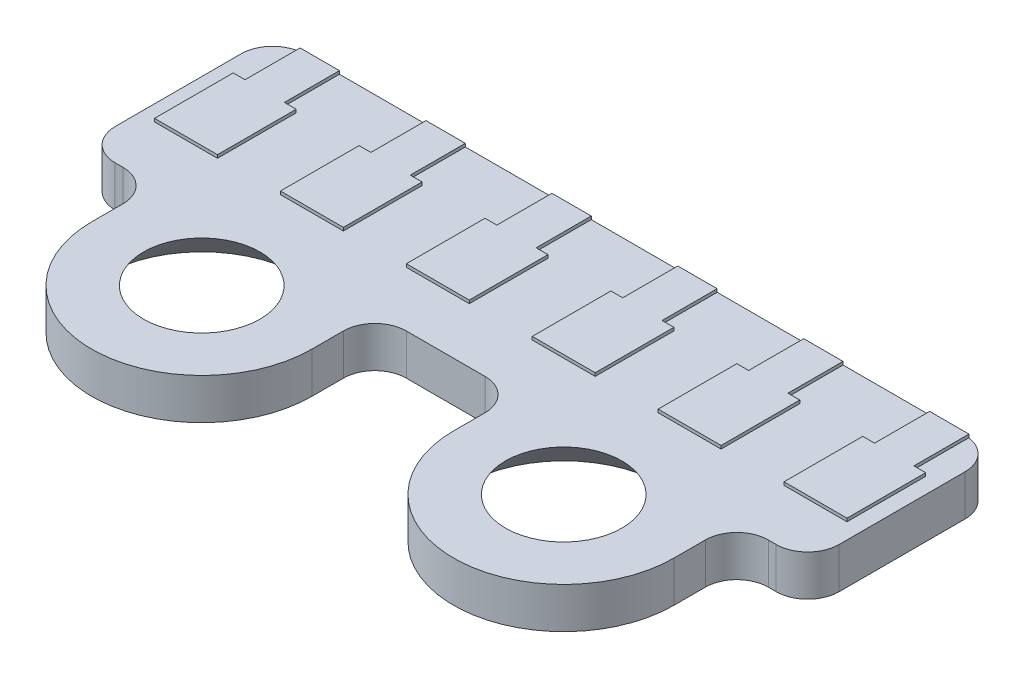
from build123d import *

# Parameters (mm, degrees)
SKETCH1_R                                      = 1.5
BOSS_EXTRUDE1_DEPTH                            = 1.3
FILLET1_R                                      = 1
BOSS_EXTRUDE3_DEPTH                            = 0.1
BOSS_EXTRUDE3_DEPTH_BACK                       = 1.4
CSK_FOR_M3_FLAT_HEAD_MACHINE_SCREW2_AT_2_COUNT = 2
CSK_FOR_M3_FLAT_HEAD_MACHINE_SCREW2_AT_2_PITCH = 11.5


with BuildPart() as part:
    # Sketch1 → Boss-Extrude1 (new body)
    with BuildSketch(Plane(origin=(0, 0, 0), x_dir=(1, 0, 0), z_dir=(0, 1, 0))):
        with BuildLine():
            Line((-11.5, 3), (11.5, 3))
            Line((11.5, 3), (11.5, -3))
            Line((11.5, -3), (9.25, -3))
            Line((9.25, -3), (9.25, -5))
            ThreePointArc((9.25, -5), (5.75, -8.5), (2.25, -5))
            Line((2.25, -5), (2.25, -3))
            Line((2.25, -3), (-2.25, -3))
            Line((-2.25, -3), (-2.25, -5))
            ThreePointArc((-2.25, -5), (-5.75, -8.5), (-9.25, -5))
            Line((-9.25, -5), (-9.25, -3))
            Line((-9.25, -3), (-11.5, -3))
            Line((-11.5, -3), (-11.5, 3))
        make_face()
        with Locations(Location((5.75, -5, 0), (0, 0, 270))):
            Circle(SKETCH1_R, mode=Mode.SUBTRACT)
        with Locations(Location((-5.75, -5, 0), (0, 0, 270))):
            Circle(SKETCH1_R, mode=Mode.SUBTRACT)
    extrude(amount=BOSS_EXTRUDE1_DEPTH)

    # Fillet1
    fillet1_edges = [part.edges().sort_by_distance(p)[0] for p in [
        (9.25, 0.65, 3),
        (2.25, 0.65, 3),
        (-2.25, 0.65, 3),
        (-9.25, 0.65, 3),
        (-11.5, 0.65, 3),
        (-11.5, 0.65, -3),
        (11.5, 0.65, -3),
        (11.5, 0.65, 3),
    ]]
    fillet(fillet1_edges, radius=FILLET1_R)

    # Sketch5 → Boss-Extrude3 (add, two sides: drawn at the far end of the back side and taken through both)
    with BuildSketch(Plane(origin=(0, 1.3, 0), x_dir=(1, 0, 0), z_dir=(0, 1, 0)).offset(-BOSS_EXTRUDE3_DEPTH_BACK)):
        Polygon((-11, -1.25), (-9, -1.25), (-9, 1.25), (-9.375, 1.25), (-9.375, 3), (-10.625, 3), (-10.625, 1.25), (-11, 1.25), align=None)
        Polygon((-7, -1.25), (-5, -1.25), (-5, 1.25), (-5.375, 1.25), (-5.375, 3), (-6.625, 3), (-6.625, 1.25), (-7, 1.25), align=None)
        Polygon((-3, -1.25), (-1, -1.25), (-1, 1.25), (-1.375, 1.25), (-1.375, 3), (-2.625, 3), (-2.625, 1.25), (-3, 1.25), align=None)
        Polygon((1, -1.25), (3, -1.25), (3, 1.25), (2.625, 1.25), (2.625, 3), (1.375, 3), (1.375, 1.25), (1, 1.25), align=None)
        Polygon((5, -1.25), (7, -1.25), (7, 1.25), (6.625, 1.25), (6.625, 3), (5.375, 3), (5.375, 1.25), (5, 1.25), align=None)
        Polygon((9, -1.25), (11, -1.25), (11, 1.25), (10.625, 1.25), (10.625, 3), (9.375, 3), (9.375, 1.25), (9, 1.25), align=None)
    extrude(amount=BOSS_EXTRUDE3_DEPTH + BOSS_EXTRUDE3_DEPTH_BACK)

    # Sketch7 → CSK for M3 Flat Head Machine Screw2 (revolve, cut)
    with BuildSketch(Plane(origin=(5.75, 0, 5), x_dir=(0, 0, -1), z_dir=(1, 0, 0))):
        Polygon((0, 0), (0, 1.4), (1.7, 1.4), (1.7, 1.45), (3.15, 0), align=None)
    csk_for_m3_flat_head_machine_screw2 = revolve(axis=Axis((5.75, -6.35, 5), (0, 1, 0)), mode=Mode.SUBTRACT)

    # CSK for M3 Flat Head Machine Screw2 at 2: CSK for M3 Flat Head Machine Screw2 ×2
    with Locations(*[(-i * CSK_FOR_M3_FLAT_HEAD_MACHINE_SCREW2_AT_2_PITCH, 0, 0) for i in range(1, CSK_FOR_M3_FLAT_HEAD_MACHINE_SCREW2_AT_2_COUNT)]):
        add(csk_for_m3_flat_head_machine_screw2, mode=Mode.SUBTRACT)


solid = part.part
